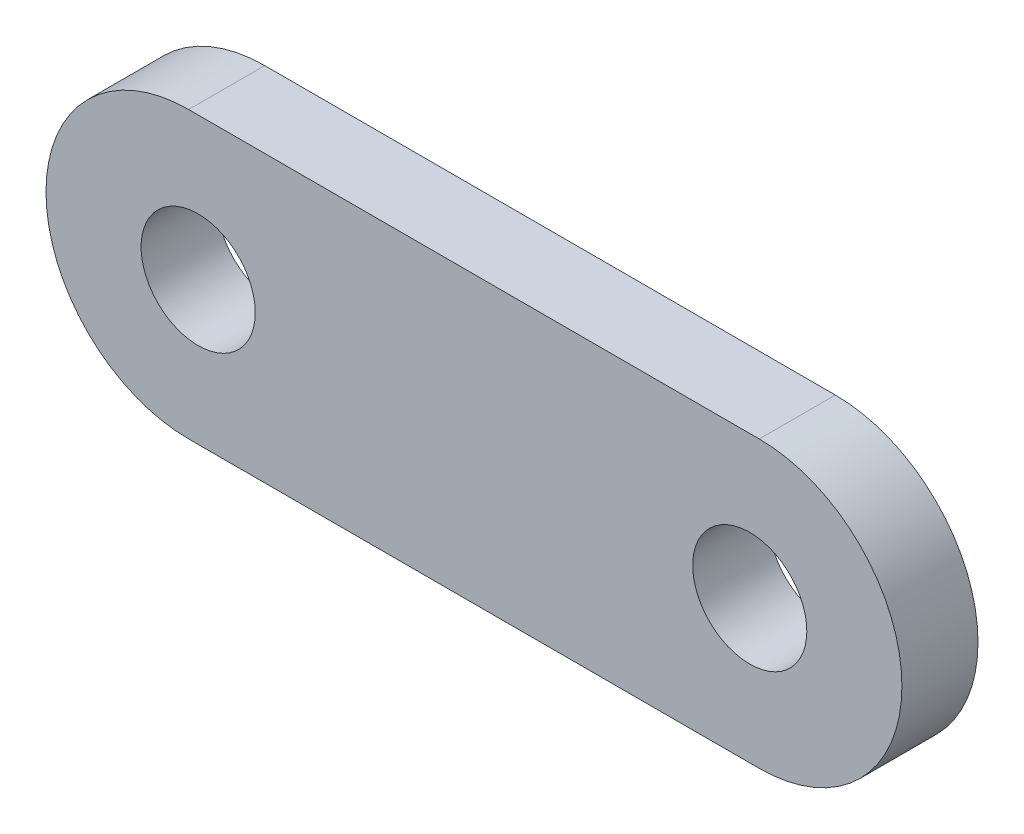
from build123d import *

# Parameters (mm, degrees)
SKETCH_1_R      = 3
EXTRUDE_1_DEPTH = 4


with BuildPart() as part:
    # Эскиз1 → Бобышка-Вытянуть1 (new body)
    with BuildSketch(Plane.XY):
        with BuildLine():
            Line((7.488567898, 0), (37.488567898, 0))
            ThreePointArc((37.488567898, 0), (44.988567898, 7.5), (37.488567898, 15))
            Line((37.488567898, 15), (7.488567898, 15))
            ThreePointArc((7.488567898, 15), (-0.011432102, 7.5), (7.488567898, 0))
        make_face()
        with Locations((7.988567898, 7.5)):
            Circle(SKETCH_1_R, mode=Mode.SUBTRACT)
        with Locations((36.988567898, 7.5)):
            Circle(SKETCH_1_R, mode=Mode.SUBTRACT)
    extrude(amount=EXTRUDE_1_DEPTH)


solid = part.part
